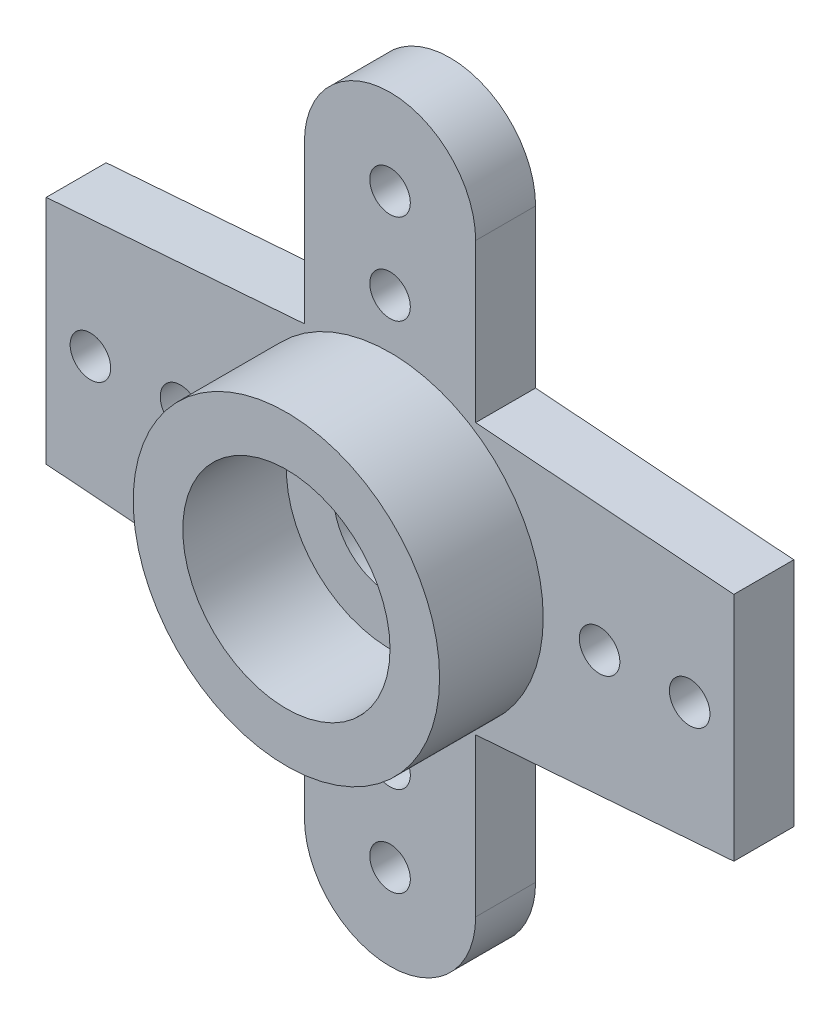
from build123d import *

# Parameters (mm, degrees)
AUFSATZ_LINEAR_AUSTRAGEN1_DEPTH      = 1.33
AUFSATZ_LINEAR_AUSTRAGEN2_DEPTH      = 2.3
AUFSATZ_LINEAR_AUSTRAGEN2_DEPTH_BACK = 1.33
SKIZZE2_R                            = 3.4
SKIZZE2_R_2                          = 2.3
SKIZZE3_R                            = 1.25
SCHNITT_LINEAR_AUSTRAGEN1_DEPTH      = 21.470115412
SKIZZE4_R                            = 2.35
SCHNITT_LINEAR_AUSTRAGEN2_DEPTH      = 1.1
SKIZZE5_R                            = 0.45
SCHNITT_LINEAR_AUSTRAGEN3_DEPTH      = 21.470115412
SCHNITT_LINEAR_AUSTRAGEN4_DEPTH      = 1.33


with BuildPart() as part:
    # Skizze1 → Aufsatz-Linear austragen1 (new body)
    with BuildSketch(Plane.XY):
        with BuildLine():
            Line((-16.79191458, 1.869621687), (-1.9, 3))
            Line((-1.9, 3), (-1.9, 6.5))
            ThreePointArc((-1.9, 6.5), (0, 8.4), (1.9, 6.5))
            Line((1.9, 6.5), (1.9, 3))
            Line((1.9, 3), (16.79191458, 1.869621687))
            ThreePointArc((16.79191458, 1.869621687), (18.525, 0), (16.79191458, -1.869621687))
            Line((16.79191458, -1.869621687), (1.9, -3))
            Line((1.9, -3), (1.9, -6.5))
            ThreePointArc((1.9, -6.5), (0, -8.4), (-1.9, -6.5))
            Line((-1.9, -6.5), (-1.9, -3))
            Line((-1.9, -3), (-16.79191458, -1.869621687))
            ThreePointArc((-16.79191458, -1.869621687), (-18.525, 0), (-16.79191458, 1.869621687))
        make_face()
    extrude(amount=AUFSATZ_LINEAR_AUSTRAGEN1_DEPTH)

    # Skizze2 → Aufsatz-Linear austragen2 (add, two sides: drawn at the far end of the back side and taken through both)
    with BuildSketch(Plane.XY.offset(1.33).offset(-AUFSATZ_LINEAR_AUSTRAGEN2_DEPTH_BACK)):
        Circle(SKIZZE2_R)
        Circle(SKIZZE2_R_2, mode=Mode.SUBTRACT)
    extrude(amount=AUFSATZ_LINEAR_AUSTRAGEN2_DEPTH + AUFSATZ_LINEAR_AUSTRAGEN2_DEPTH_BACK)

    # Skizze3 → Schnitt-Linear austragen1 (cut, through all)
    with BuildSketch(Plane.XY.offset(1.33)):
        Circle(SKIZZE3_R)
    extrude(amount=-SCHNITT_LINEAR_AUSTRAGEN1_DEPTH, mode=Mode.SUBTRACT)

    # Skizze4 → Schnitt-Linear austragen2 (cut)
    with BuildSketch(Plane(origin=(0, 0, 0), x_dir=(-1, 0, 0), z_dir=(0, 0, -1))):
        Circle(SKIZZE4_R)
    extrude(amount=-SCHNITT_LINEAR_AUSTRAGEN2_DEPTH, mode=Mode.SUBTRACT)

    # Skizze5 → Schnitt-Linear austragen3 (cut, through all)
    with BuildSketch(Plane.XY.offset(1.33)):
        with Locations((0, 6.5)):
            Circle(SKIZZE5_R)
        with Locations((-16.65, 0)):
            Circle(SKIZZE5_R)
        with Locations((0, 4.5)):
            Circle(SKIZZE5_R)
        with Locations((-14.65, 0)):
            Circle(SKIZZE5_R)
        with Locations((-12.65, 0)):
            Circle(SKIZZE5_R)
        with Locations((-10.65, 0)):
            Circle(SKIZZE5_R)
        with Locations((-8.65, 0)):
            Circle(SKIZZE5_R)
        with Locations((-6.65, 0)):
            Circle(SKIZZE5_R)
        with Locations((-4.65, 0)):
            Circle(SKIZZE5_R)
        with Locations(Location((0, -4.5, 0), (0, 0, 180))):
            Circle(SKIZZE5_R)
        with Locations(Location((0, -6.5, 0), (0, 0, 180))):
            Circle(SKIZZE5_R)
        with Locations(Location((4.65, 0, 0), (0, 0, 180))):
            Circle(SKIZZE5_R)
        with Locations(Location((6.65, 0, 0), (0, 0, 180))):
            Circle(SKIZZE5_R)
        with Locations(Location((8.65, 0, 0), (0, 0, 180))):
            Circle(SKIZZE5_R)
        with Locations(Location((10.65, 0, 0), (0, 0, 180))):
            Circle(SKIZZE5_R)
        with Locations(Location((12.65, 0, 0), (0, 0, 180))):
            Circle(SKIZZE5_R)
        with Locations(Location((14.65, 0, 0), (0, 0, 180))):
            Circle(SKIZZE5_R)
        with Locations(Location((16.65, 0, 0), (0, 0, 180))):
            Circle(SKIZZE5_R)
    extrude(amount=-SCHNITT_LINEAR_AUSTRAGEN3_DEPTH, mode=Mode.SUBTRACT)

    # Skizze6 → Schnitt-Linear austragen4 (cut)
    with BuildSketch(Plane(origin=(0, 0, 0), x_dir=(-1, 0, 0), z_dir=(0, 0, -1))):
        Polygon((-7.630661654, -0.069500342), (-7.630661654, 5.641889325), (-18.981826271, 5.641889325), (-18.981826271, -4.018658181), (-7.630661654, -4.018658181), align=None)
        Polygon((7.630661654, -4.018658181), (7.630661654, -0.069500342), (7.630661654, 5.641889325), (18.981826271, 5.641889325), (18.981826271, -4.018658181), align=None)
    extrude(amount=-SCHNITT_LINEAR_AUSTRAGEN4_DEPTH, mode=Mode.SUBTRACT)


solid = part.part
